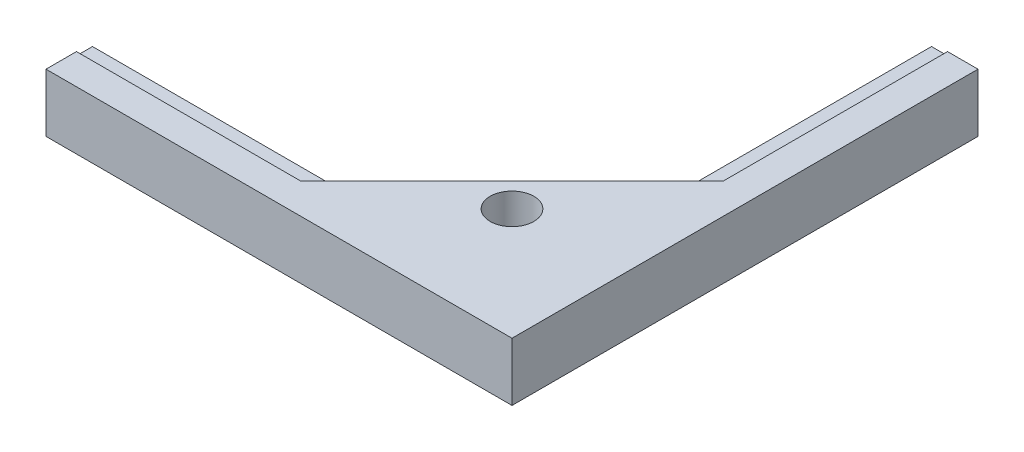
from build123d import *

# Parameters (mm, degrees)
SKETCH_1_R      = 3
EXTRUDE_1_DEPTH = 8
EXTRUDE_START   = -4
EXTRUDE_3_DEPTH = 3.5


with BuildPart() as part:
    # 草图1 → 凸台-拉伸1 (new body)
    with BuildSketch(Plane(origin=(0, 0, 0), x_dir=(1, 0, 0), z_dir=(0, 1, 0))):
        Polygon((0, 0), (0, 64), (-4.185096591, 64), (-4.185096591, 33.185096591), (-33.185096591, 4.185096591), (-64, 4.185096591), (-64, 0), align=None)
        with Locations(Location((-15.385096591, 15.385096591, 0), (0, 0, 270))):
            Circle(SKETCH_1_R, mode=Mode.SUBTRACT)
    extrude(amount=EXTRUDE_1_DEPTH)

    # 草图4 → 凸台-拉伸3 (add, symmetric)
    with BuildSketch(Plane.XZ.offset(EXTRUDE_START)):
        Polygon((-6.385096591, -30.985096591), (-6.385096591, -64), (-4.185096591, -64), (-4.185096591, -33.185096591), align=None)
        Polygon((-64, -4.185096591), (-64, -6.385096591), (-30.985096591, -6.385096591), (-33.185096591, -4.185096591), align=None)
    extrude(amount=EXTRUDE_3_DEPTH, both=True)


solid = part.part
